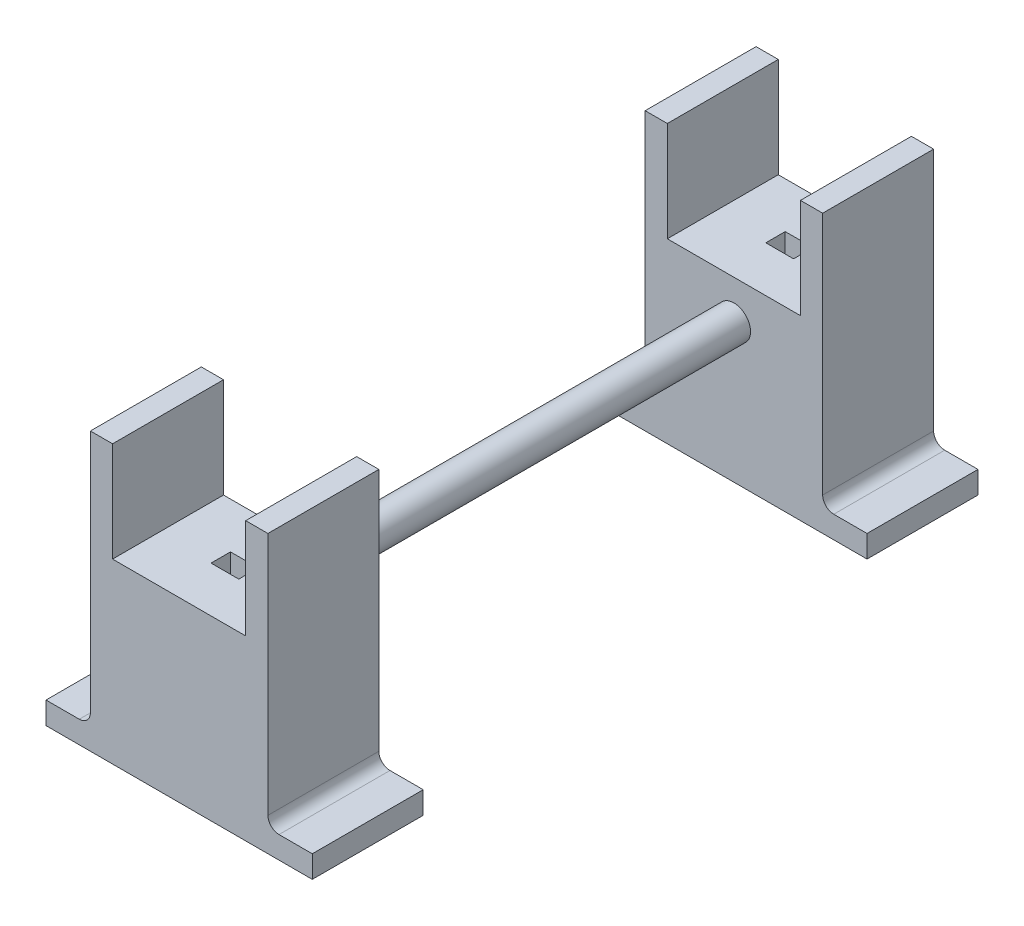
from build123d import *

# Parameters (mm, degrees)
SKETCH1_R            = 3
BOSS_EXTRUDE1_DEPTH  = 40
SKETCH2_W            = 32
SKETCH2_H            = 50
BOSS_EXTRUDE2_DEPTH  = 20
SKETCH9_W            = 48
SKETCH9_H            = 20
BOSS_EXTRUDE5_DEPTH  = 4
FILLET1_R            = 2
SKETCH10_W           = 24
SKETCH10_H           = 20
CUT_EXTRUDE2_DEPTH   = 18
SKETCH11_W           = 5
SKETCH11_H           = 3.5
CUT_EXTRUDE3_DEPTH   = 5
FILLET1_OF_MIRROR5_R = 2


with BuildPart() as part:
    # Sketch1 → Boss-Extrude1 (new, symmetric)
    with BuildSketch(Plane.XY):
        Circle(SKETCH1_R)
    extrude(amount=BOSS_EXTRUDE1_DEPTH, both=True)

    # Sketch2 → Boss-Extrude2 (add)
    with BuildSketch(Plane.XY.offset(40)):
        Rectangle(SKETCH2_W, SKETCH2_H)
    boss_extrude2 = extrude(amount=BOSS_EXTRUDE2_DEPTH)

    # Sketch9 → Boss-Extrude5 (add)
    with BuildSketch(Plane.XZ.offset(25)):
        with Locations((0, 50)):
            Rectangle(SKETCH9_W, SKETCH9_H)
    boss_extrude5 = extrude(amount=-BOSS_EXTRUDE5_DEPTH)

    # Fillet1
    fillet1_edges = [part.edges().sort_by_distance(p)[0] for p in [
        (-16, -21, 50),
        (16, -21, 50),
    ]]
    fillet(fillet1_edges, radius=FILLET1_R)

    # Sketch10 → Cut-Extrude2 (cut)
    with BuildSketch(Plane(origin=(0, 25, 0), x_dir=(1, 0, 0), z_dir=(0, 1, 0))):
        with Locations((0, -50)):
            Rectangle(SKETCH10_W, SKETCH10_H)
    cut_extrude2 = extrude(amount=-CUT_EXTRUDE2_DEPTH, mode=Mode.SUBTRACT)

    # Sketch11 → Cut-Extrude3 (cut)
    with BuildSketch(Plane(origin=(0, 7, 0), x_dir=(1, 0, 0), z_dir=(0, 1, 0))):
        with Locations((0, -50)):
            Rectangle(SKETCH11_W, SKETCH11_H)
    cut_extrude3 = extrude(amount=-CUT_EXTRUDE3_DEPTH, mode=Mode.SUBTRACT)

    # Mirror5: Boss-Extrude2, Boss-Extrude5, Cut-Extrude2, Cut-Extrude3 across plane
    add(boss_extrude2.mirror(Plane.XY))
    add(boss_extrude5.mirror(Plane.XY))
    add(cut_extrude2.mirror(Plane.XY), mode=Mode.SUBTRACT)
    add(cut_extrude3.mirror(Plane.XY), mode=Mode.SUBTRACT)

    # Fillet1 of Mirror5
    fillet1_of_mirror5_edges = [part.edges().sort_by_distance(p)[0] for p in [
        (-16, -21, -50),
        (16, -21, -50),
    ]]
    fillet(fillet1_of_mirror5_edges, radius=FILLET1_OF_MIRROR5_R)


solid = part.part
